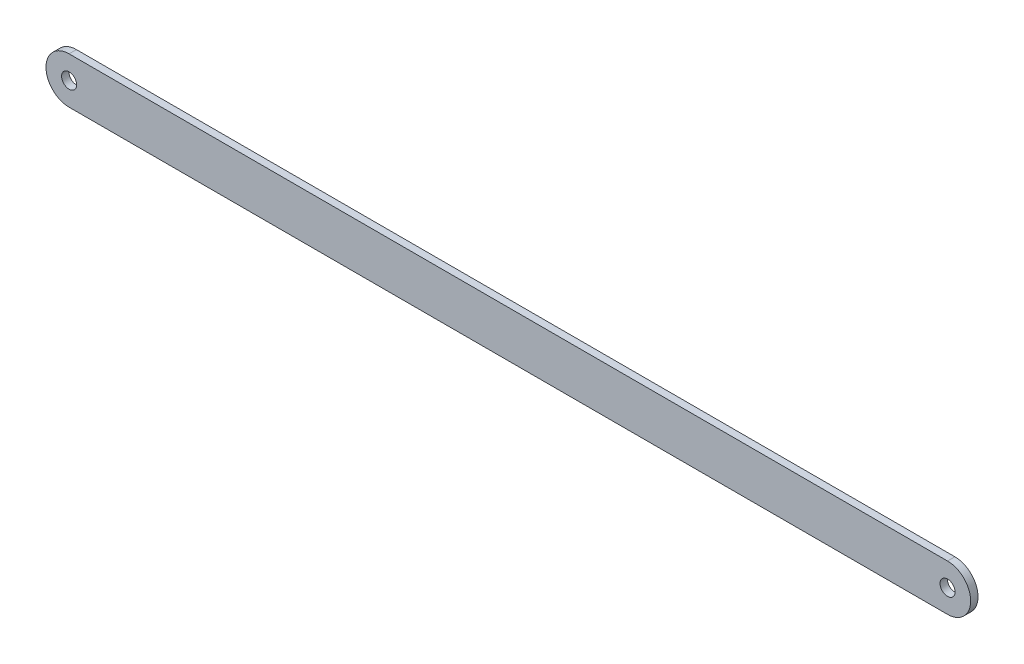
from build123d import *

# Parameters (mm, degrees)
SKETCH1_R           = 3.25
BOSS_EXTRUDE1_DEPTH = 3.175


with BuildPart() as part:
    # Sketch1 → Boss-Extrude1 (new body)
    with BuildSketch(Plane.XY):
        with BuildLine():
            Line((0, 10), (380, 10))
            ThreePointArc((380, 10), (390, 0), (380, -10))
            Line((380, -10), (0, -10))
            ThreePointArc((0, -10), (-10, 0), (0, 10))
        make_face()
        Circle(SKETCH1_R, mode=Mode.SUBTRACT)
        with Locations((380, 0)):
            Circle(SKETCH1_R, mode=Mode.SUBTRACT)
    extrude(amount=BOSS_EXTRUDE1_DEPTH)


solid = part.part
